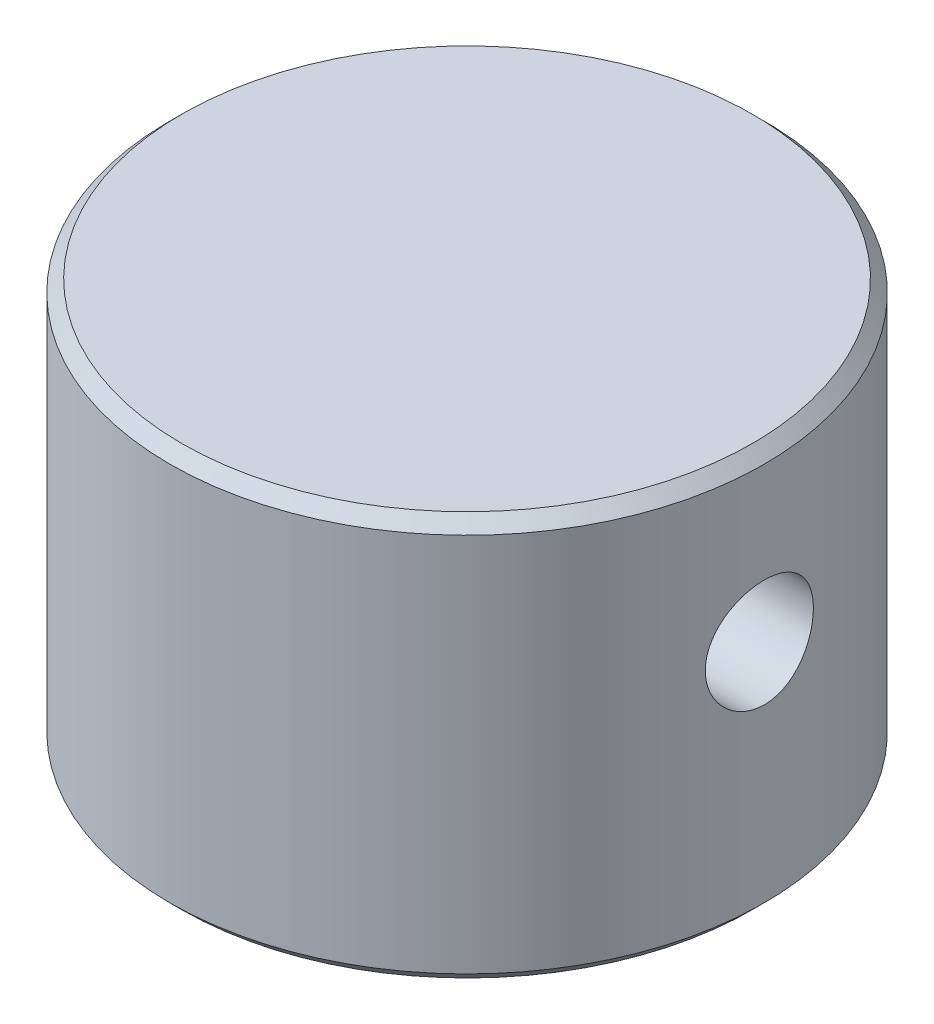
from build123d import *

# Parameters (mm, degrees)
SKETCH2_R           = 12.45
BOSS_EXTRUDE1_DEPTH = 16.915
SKETCH6_R           = 11
CUT_EXTRUDE2_DEPTH  = 15.5
BOSS_EXTRUDE2_START = 9
BOSS_EXTRUDE2_DEPTH = 9
SKETCH5_R           = 2.265
CUT_EXTRUDE1_DEPTH  = 33.574986186
CHAMFER1_SIZE       = 0.5
CHAMFER2_SIZE       = 0.5


with BuildPart() as part:
    # Sketch2 → Boss-Extrude1 (new body)
    with BuildSketch(Plane(origin=(0, 0, 0), x_dir=(1, 0, 0), z_dir=(0, 1, 0))):
        with Locations(Location((0, 0, 0), (0, 0, 270))):
            Circle(SKETCH2_R)
    extrude(amount=BOSS_EXTRUDE1_DEPTH)

    # Sketch6 → Cut-Extrude2 (cut)
    with BuildSketch(Plane.XZ):
        with Locations(Location((0, 0, 0), (0, 0, 270))):
            Circle(SKETCH6_R)
    extrude(amount=-CUT_EXTRUDE2_DEPTH, mode=Mode.SUBTRACT)

    # Sketch7 → Boss-Extrude2 (add)
    with BuildSketch(Plane.XZ.offset(-15.5).offset(BOSS_EXTRUDE2_START)):
        with BuildLine():
            Line((-4, 10.246950766), (-4, -10.246950766))
            ThreePointArc((-4, -10.246950766), (-11, 0), (-4, 10.246950766))
        make_face()
        with BuildLine():
            Line((4, 10.246950766), (4, -10.246950766))
            ThreePointArc((4, -10.246950766), (11, 0), (4, 10.246950766))
        make_face()
    extrude(amount=-BOSS_EXTRUDE2_DEPTH)

    # Sketch5 → Cut-Extrude1 (cut, through all)
    with BuildSketch(Plane(origin=(12.45, 0, 0), x_dir=(0, 0, -1), z_dir=(1, 0, 0))):
        with Locations((0, 9.95)):
            Circle(SKETCH5_R)
    extrude(amount=-CUT_EXTRUDE1_DEPTH, mode=Mode.SUBTRACT)

    # Chamfer1
    chamfer1_edges = [part.edges().sort_by_distance(p)[0] for p in [
        (0, 16.915, -12.45),
    ]]
    chamfer(chamfer1_edges, length=CHAMFER1_SIZE)

    # Chamfer2
    chamfer2_edges = [part.edges().sort_by_distance(p)[0] for p in [
        (0, 0, -12.45),
    ]]
    chamfer(chamfer2_edges, length=CHAMFER2_SIZE)


solid = part.part
